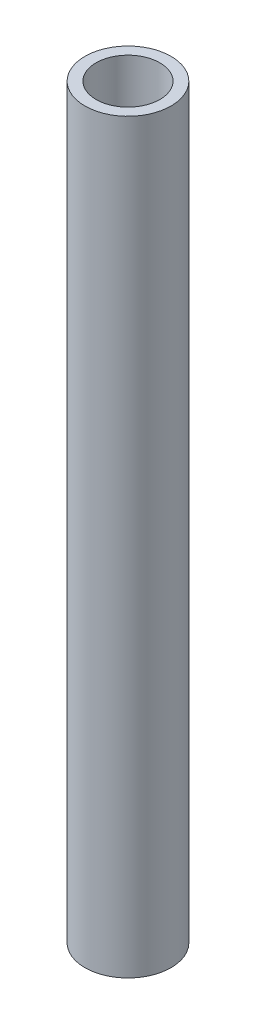
from build123d import *

# Parameters (mm, degrees)
SKETCH1_R           = 10.668
SKETCH1_R_2         = 7.8994
BOSS_EXTRUDE1_DEPTH = 184.94375


with BuildPart() as part:
    # Sketch1 → Boss-Extrude1 (new body)
    with BuildSketch(Plane(origin=(0, 0, 0), x_dir=(1, 0, 0), z_dir=(0, 1, 0))):
        with Locations(Location((0, 0, 0), (0, 0, 270))):
            Circle(SKETCH1_R)
        with Locations(Location((0, 0, 0), (0, 0, 270))):
            Circle(SKETCH1_R_2, mode=Mode.SUBTRACT)
    extrude(amount=BOSS_EXTRUDE1_DEPTH)


solid = part.part
